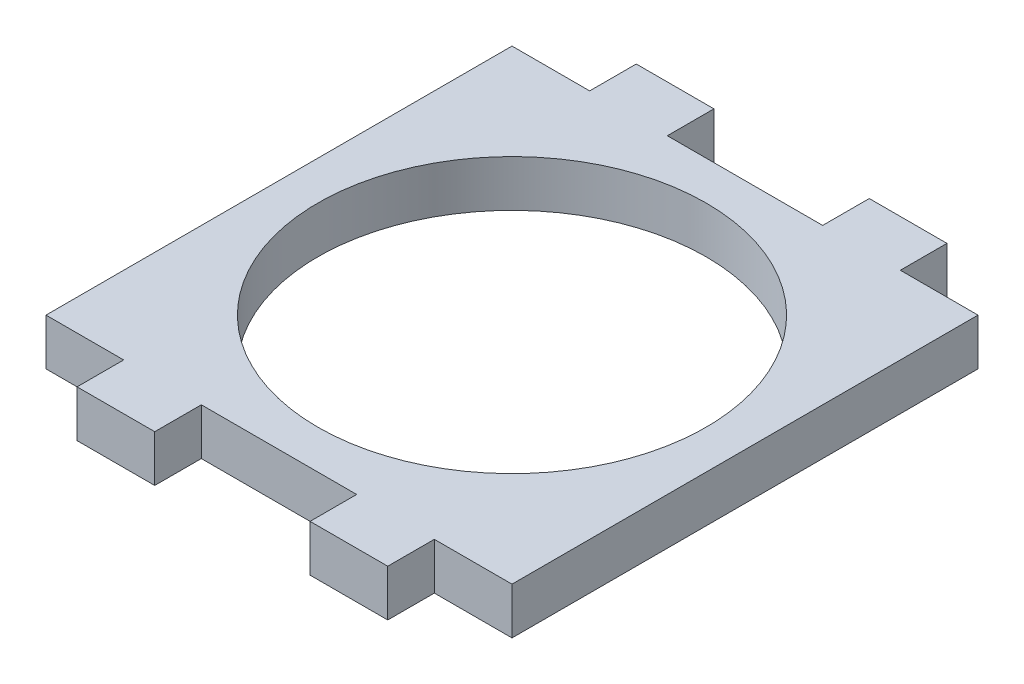
from build123d import *

# Parameters (mm, degrees)
SKETCH1_R           = 25
BOSS_EXTRUDE1_DEPTH = 6


with BuildPart() as part:
    # Sketch1 → Boss-Extrude1 (new body)
    with BuildSketch(Plane(origin=(0, 0, 0), x_dir=(1, 0, 0), z_dir=(0, 1, 0))):
        Polygon((-20, 30), (-30, 30), (-30, -30), (-20, -30), (-20, -36), (-10, -36), (-10, -30), (10, -30), (10, -36), (20, -36), (20, -30), (30, -30), (30, 30), (20, 30), (20, 36), (10, 36), (10, 30), (-10, 30), (-10, 36), (-20, 36), align=None)
        with Locations(Location((0, 0, 0), (0, 0, 270))):
            Circle(SKETCH1_R, mode=Mode.SUBTRACT)
    extrude(amount=BOSS_EXTRUDE1_DEPTH)


solid = part.part
